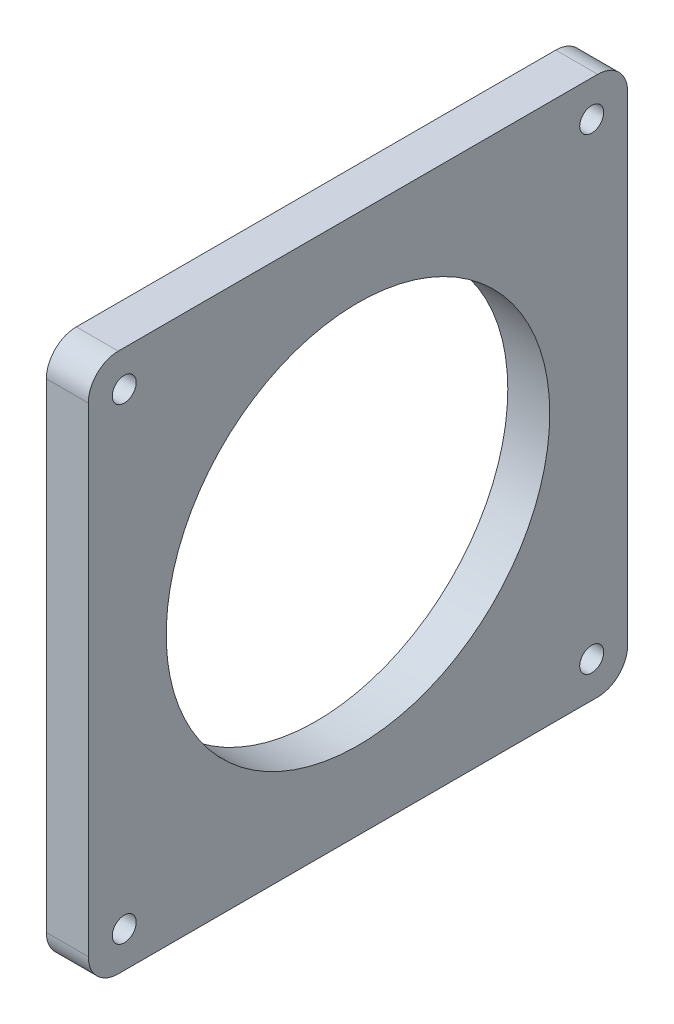
from build123d import *

# Parameters (mm, degrees)
ESQUISSE1_R             = 45
ESQUISSE1_R_2           = 32
BOSS_EXTRU_1_DEPTH      = 7
ESQUISSE3_R             = 2.5
ESQUISSE3_R_2           = 4
ENL_V_MAT_EXTRU_1_DEPTH = 65.02343321
BOSS_EXTRU_3_START      = -7
ESQUISSE4_W             = 90
ESQUISSE4_H             = 90
ESQUISSE4_R             = 32
BOSS_EXTRU_3_DEPTH      = 7
ESQUISSE5_R             = 2
ENL_V_MAT_EXTRU_2_DEPTH = 65.02343321
CONG_1_R                = 5


with BuildPart() as part:
    # Esquisse1 → Boss.-Extru.1 (new body)
    with BuildSketch(Plane(origin=(0, 0, 0), x_dir=(0, 0, -1), z_dir=(1, 0, 0))):
        Circle(ESQUISSE1_R)
        Circle(ESQUISSE1_R_2, mode=Mode.SUBTRACT)
    extrude(amount=BOSS_EXTRU_1_DEPTH)

    # Esquisse3 → Enlèv. mat.-Extru.1 (cut, through all)
    with BuildSketch(Plane(origin=(7, 0, 0), x_dir=(0, 0, -1), z_dir=(1, 0, 0))):
        with Locations((0, 38)):
            Circle(ESQUISSE3_R)
        with Locations((32.908965344, 19)):
            Circle(ESQUISSE3_R)
        with Locations((32.908965344, -19)):
            Circle(ESQUISSE3_R)
        with Locations((0, -38)):
            Circle(ESQUISSE3_R)
        with Locations((-32.908965344, -19)):
            Circle(ESQUISSE3_R)
        with Locations((-32.908965344, 19)):
            Circle(ESQUISSE3_R)
        with Locations((-20.848699038, 32.366367551)):
            Circle(ESQUISSE3_R_2)
        with Locations((38.454446046, 1.872319227)):
            Circle(ESQUISSE3_R_2)
        with Locations((-17.605747008, -34.238686778)):
            Circle(ESQUISSE3_R_2)
    extrude(amount=-ENL_V_MAT_EXTRU_1_DEPTH, mode=Mode.SUBTRACT)

    # Esquisse4 → Boss.-Extru.3 (add)
    with BuildSketch(Plane(origin=(7, 0, 0), x_dir=(0, 0, -1), z_dir=(1, 0, 0)).offset(BOSS_EXTRU_3_START)):
        Rectangle(ESQUISSE4_W, ESQUISSE4_H)
        Circle(ESQUISSE4_R, mode=Mode.SUBTRACT)
    extrude(amount=BOSS_EXTRU_3_DEPTH)

    # Esquisse5 → Enlèv. mat.-Extru.2 (cut, through all)
    with BuildSketch(Plane.ZY):
        with Locations((-39, 39)):
            Circle(ESQUISSE5_R)
        with Locations(Location((39, 39, 0), (0, 0, 180))):
            Circle(ESQUISSE5_R)
        with Locations((39, -39)):
            Circle(ESQUISSE5_R)
        with Locations(Location((-39, -39, 0), (0, 0, 180))):
            Circle(ESQUISSE5_R)
    extrude(amount=-ENL_V_MAT_EXTRU_2_DEPTH, mode=Mode.SUBTRACT)

    # Congé1
    cong_1_edges = [part.edges().sort_by_distance(p)[0] for p in [
        (3.5, -45, 45),
        (3.5, 45, 45),
        (3.5, -45, -45),
        (3.5, 45, -45),
    ]]
    fillet(cong_1_edges, radius=CONG_1_R)


solid = part.part
